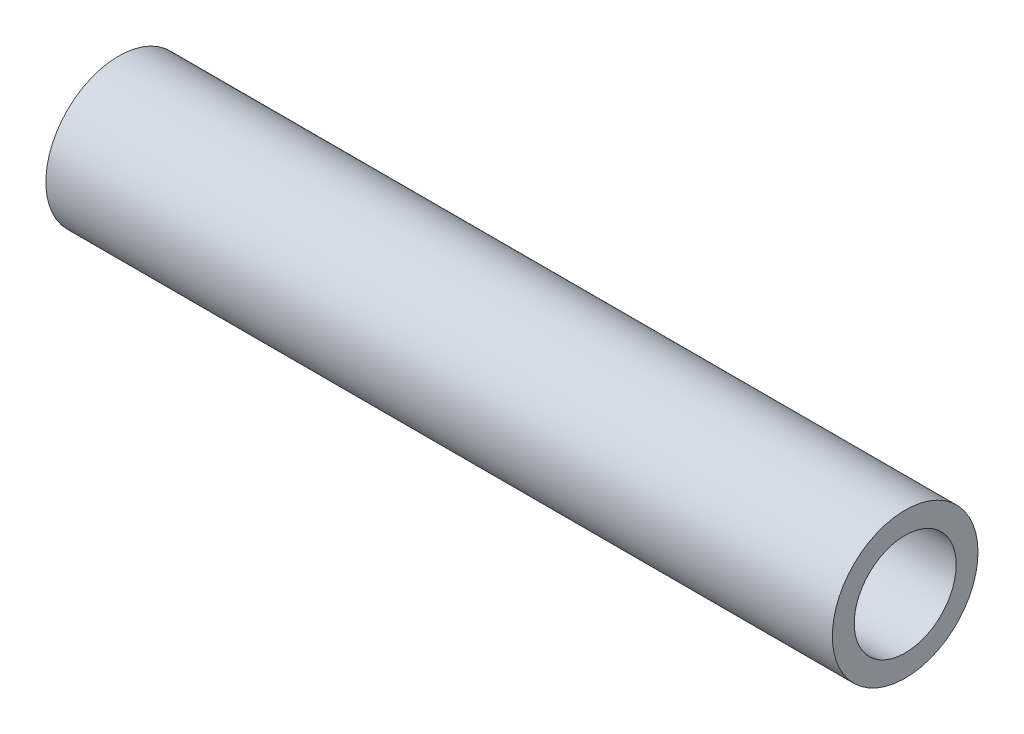
from build123d import *

# Parameters (mm, degrees)
SALIENTE_EXTRUIR1_DEPTH      = 13.5
SALIENTE_EXTRUIR1_DEPTH_BACK = 13.5
CROQUIS1_R                   = 2.5
CROQUIS1_R_2                 = 1.75


with BuildPart() as part:
    # Croquis1 → Saliente-Extruir1 (new, two sides: drawn at the far end of the back side and taken through both)
    with BuildSketch(Plane(origin=(0, 0, 0), x_dir=(0, 0, -1), z_dir=(1, 0, 0)).offset(-SALIENTE_EXTRUIR1_DEPTH_BACK)):
        Circle(CROQUIS1_R)
        Circle(CROQUIS1_R_2, mode=Mode.SUBTRACT)
    extrude(amount=SALIENTE_EXTRUIR1_DEPTH + SALIENTE_EXTRUIR1_DEPTH_BACK)


solid = part.part
